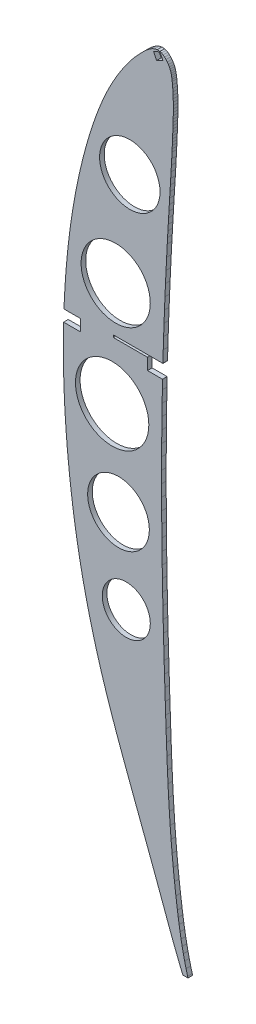
from build123d import *

# Parameters (mm, degrees)
MODEL_R         = 14.977427864
MODEL_R_2       = 15.880273782
MODEL_R_3       = 13.353147906
MODEL_R_4       = 10.401275396
MODEL_R_5       = 13.084634334
EXTRUDE_1_DEPTH = 2


with BuildPart() as part:
    # Model → 凸台-拉伸1 (new body)
    with BuildSketch(Plane.XY):
        Polygon((88.479856713, 6.907057507), (88.272028346, 7.384946027), (87.235379117, 9.876099048), (86.220316374, 12.37720313), (85.245568714, 14.849037873), (84.290540301, 17.327739293), (83.352233991, 19.813176532), (82.426740831, 22.303177017), (81.510108247, 24.79656722), (80.596429188, 27.291087329), (79.683661938, 29.787649155), (77.847443245, 34.773299655), (75.99849864, 39.752388814), (74.14073708, 44.727089205), (72.274158562, 49.697400829), (70.403583852, 54.667537975), (68.531011046, 59.637587883), (66.659350049, 64.609679506), (64.801723544, 69.558361024), (62.957909237, 74.511649407), (61.13785399, 79.470979896), (59.349288472, 84.442695736), (57.604157644, 89.428319407), (55.910235794, 94.433195106), (54.277426166, 99.459757124), (52.746492627, 104.399680453), (51.285749982, 109.359684579), (49.895198232, 114.339769501), (48.576879091, 119.339023409), (47.330792561, 124.357446305), (46.158024927, 129.39308371), (45.060487048, 134.448020961), (44.054006009, 139.434865245), (43.120062915, 144.433885179), (42.25665967, 149.444993523), (41.459843702, 154.467016752), (40.72861596, 159.499911246), (40.060022921, 164.542547099), (39.453109156, 169.593881644), (38.909314103, 174.620946288), (38.424375657, 179.652582573), (37.999292865, 184.688834118), (37.635108396, 189.728745493), (37.3308232, 194.77227308), (37.089347185, 199.821545833), (36.909812158, 204.873522988), (36.791912786, 209.935197883), (36.740125075, 214.995755464), (36.752363688, 220.05710659), (36.845094354, 225.892940532), (44.138254354, 225.892940532), (44.138254354, 230.892940532), (43.138254354, 230.892940532), (36.982762849, 230.892940532), (37.198824354, 235.233025042), (37.487541806, 240.289431299), (37.853914907, 245.401277614), (38.297650915, 250.50649214), (38.821877834, 255.60220859), (39.431590903, 260.688645061), (40.128919077, 265.762891647), (40.917945789, 270.823124729), (41.803709898, 275.868563357), (42.293039299, 278.439354429), (42.809648339, 281.004329887), (43.351538919, 283.563402492), (43.920752757, 286.115660435), (44.517202613, 288.663101812), (45.140975726, 291.203728527), (45.793027524, 293.738583247), (46.491502762, 296.333520114), (47.221428307, 298.918819651), (47.984802257, 301.494569098), (48.784708995, 304.058901216), (49.621148521, 306.611816004), (50.498160647, 309.152488894), (51.417830709, 311.679009026), (51.911387176, 312.983779509), (52.418149368, 314.284121803), (52.937161854, 315.57899324), (53.47046635, 316.867482012), (54.01706381, 318.149544497), (54.579039567, 319.42326984), (55.157349051, 320.689700707), (55.780389213, 322.009133144), (56.422847484, 323.319403868), (57.08272577, 324.620425639), (57.763976642, 325.913371983), (58.464645625, 327.197156613), (59.187599004, 328.474907532), (59.931881351, 329.745582073), (60.761109625, 331.111052127), (61.614925728, 332.463582372), (62.491506041, 333.799089375), (63.389114184, 335.111491608), (64.305882918, 336.397704689), (65.240119483, 337.65064804), (66.18995664, 338.867237278), (66.781786491, 339.594744959), (67.383043971, 340.312654733), (68.000591557, 341.02426908), (68.638076489, 341.737754863), (69.300406768, 342.455328274), (69.995225825, 343.185330657), (70.725399947, 343.930890012), (71.742647308, 344.93321571), (72.818018141, 345.911053412), (73.934192265, 346.802588788), (75.078931977, 347.544227508), (76.237870621, 348.075285151), (77.396728778, 348.333079197), (78.541270652, 348.253928078), (79.242478398, 348.012284339), (79.92255684, 347.635590415), (80.569600441, 347.144346505), (81.175699855, 346.559227286), (81.727906878, 345.901688387), (82.218312164, 345.192404484), (82.636052845, 344.450920348), (82.93954048, 343.781521173), (83.186344082, 343.103641404), (83.383369751, 342.419584472), (83.539565301, 341.730742001), (83.662966738, 341.036463897), (83.763520923, 340.338185402), (83.848133956, 339.63820995), (83.977892143, 338.385677789), (84.086801175, 337.129232477), (84.173818385, 335.869829442), (84.240985489, 334.606556874), (84.291168773, 333.342542777), (84.323369188, 332.07774353), (84.3406275, 330.811290945), (84.341901041, 329.54414045), (84.331098764, 328.278464618), (84.309263337, 327.013308021), (84.278392857, 325.748757898), (84.24048542, 324.484901488), (84.197626361, 323.219827932), (84.15072749, 321.955578948), (84.101917761, 320.689244627), (84.052108984, 319.422866688), (83.999303062, 318.15635789), (83.945454473, 316.890804521), (83.889651407, 315.624164865), (83.830807576, 314.3583934), (83.770009269, 313.091535647), (83.641506555, 310.555516709), (83.503925169, 308.021103293), (83.360349493, 305.486428161), (83.210692289, 302.953489409), (83.05808156, 300.419420751), (82.903429115, 297.886263902), (82.747821241, 295.352064385), (82.594255083, 292.816953059), (82.441644354, 290.282884401), (82.292030769, 287.748946601), (82.143416233, 285.21505242), (81.997798841, 282.681289097), (81.855222214, 280.146657585), (81.71568635, 277.611157882), (81.446343389, 272.546588959), (81.191030722, 267.48163166), (80.950703779, 262.417328652), (80.724363511, 257.353636315), (80.514138872, 252.287644744), (80.318987196, 247.220309367), (80.140906578, 242.151717423), (79.978505396, 237.090816727), (79.834087082, 232.03070118), (79.830562849, 231.892940532), (58.404980562, 231.892940532), (58.404980562, 230.892940532), (73.158483633, 230.892940532), (73.158483633, 225.892940532), (79.658483633, 225.892940532), (79.592249339, 221.911521148), (79.496871627, 216.851544855), (79.416566877, 211.790224755), (79.354375852, 206.72669266), (79.306908835, 201.669809146), (79.276425638, 196.61366716), (79.259929115, 191.558135847), (79.259417365, 186.503302443), (79.271893241, 181.449036091), (79.29848665, 176.392383267), (79.337112258, 171.335254826), (79.388638253, 166.280691534), (79.452065588, 161.228649772), (79.527481503, 156.177131441), (79.613886947, 151.126092924), (79.71228097, 146.07557784), (79.821751763, 141.023544473), (79.942255705, 135.97099187), (80.07270651, 130.91987451), (80.214103226, 125.870236011), (80.362406041, 120.822900945), (80.518744861, 115.774915785), (80.68107797, 110.727192341), (80.848493559, 105.677688898), (81.019948961, 100.627360885), (81.195400555, 95.577207349), (81.379799964, 90.528445435), (81.577099761, 85.48224867), (81.794380523, 80.436924293), (82.035638442, 75.392646781), (82.308909523, 70.348766042), (82.61814634, 65.3064556), (82.96864947, 60.258940216), (83.364977961, 55.216428468), (83.808174478, 50.177964927), (84.301236168, 45.143680453), (84.849114652, 40.114792189), (85.452896218, 35.08934566), (86.115534389, 30.068470771), (86.474047972, 27.542704944), (86.85345433, 25.019853221), (87.257662415, 22.502088176), (87.693578327, 19.99171324), (88.165241878, 17.487903844), (88.6785165, 14.993918847), (89.237442004, 12.50893368), (89.857967937, 9.988601843), (90.524057515, 7.479267933), (90.696402195, 6.907057507), align=None)
        with Locations((59.382987039, 251.756041106)):
            Circle(MODEL_R, mode=Mode.SUBTRACT)
        with Locations((57.853032499, 205.794671668)):
            Circle(MODEL_R_2, mode=Mode.SUBTRACT)
        with Locations((60.60698322, 166.57432903)):
            Circle(MODEL_R_3, mode=Mode.SUBTRACT)
        with Locations((63.972915756, 131.643654893)):
            Circle(MODEL_R_4, mode=Mode.SUBTRACT)
        with Locations((65.502870296, 295.572529956)):
            Circle(MODEL_R_5, mode=Mode.SUBTRACT)
        Polygon((75.835116032, 346.808581541), (77.116766854, 344.130084779), (79.822921473, 345.424969783), (78.541270652, 348.103466545), align=None, mode=Mode.SUBTRACT)
    extrude(amount=EXTRUDE_1_DEPTH)


solid = part.part
